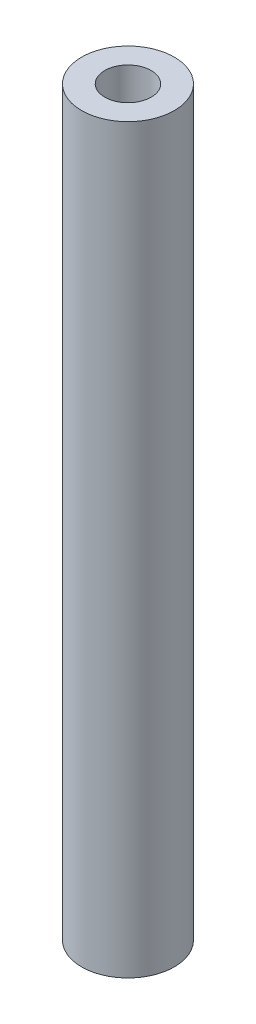
from build123d import *

# Parameters (mm, degrees)
SKETCH2_R           = 2
BOSS_EXTRUDE1_DEPTH = 32
SKETCH11_R          = 1
CUT_EXTRUDE3_DEPTH  = 5
SCALE1_SCALE        = 2


with BuildPart() as part:
    # Sketch2 → Boss-Extrude1 (new body)
    with BuildSketch(Plane(origin=(0, 0, 0), x_dir=(1, 0, 0), z_dir=(0, 1, 0))):
        with Locations(Location((0, 0, 0), (0, 0, 270))):
            Circle(SKETCH2_R)
    extrude(amount=BOSS_EXTRUDE1_DEPTH)

    # Sketch11 → Cut-Extrude3 (cut)
    with BuildSketch(Plane(origin=(0, 32, 0), x_dir=(1, 0, 0), z_dir=(0, 1, 0))):
        with Locations(Location((0, 0, 0), (0, 0, 270))):
            Circle(SKETCH11_R)
    extrude(amount=-CUT_EXTRUDE3_DEPTH, mode=Mode.SUBTRACT)


with BuildPart() as part_1:
    # Scale1: scaled about (0, 0, 0)
    add(part.part.scale(SCALE1_SCALE))


solid = part_1.part
